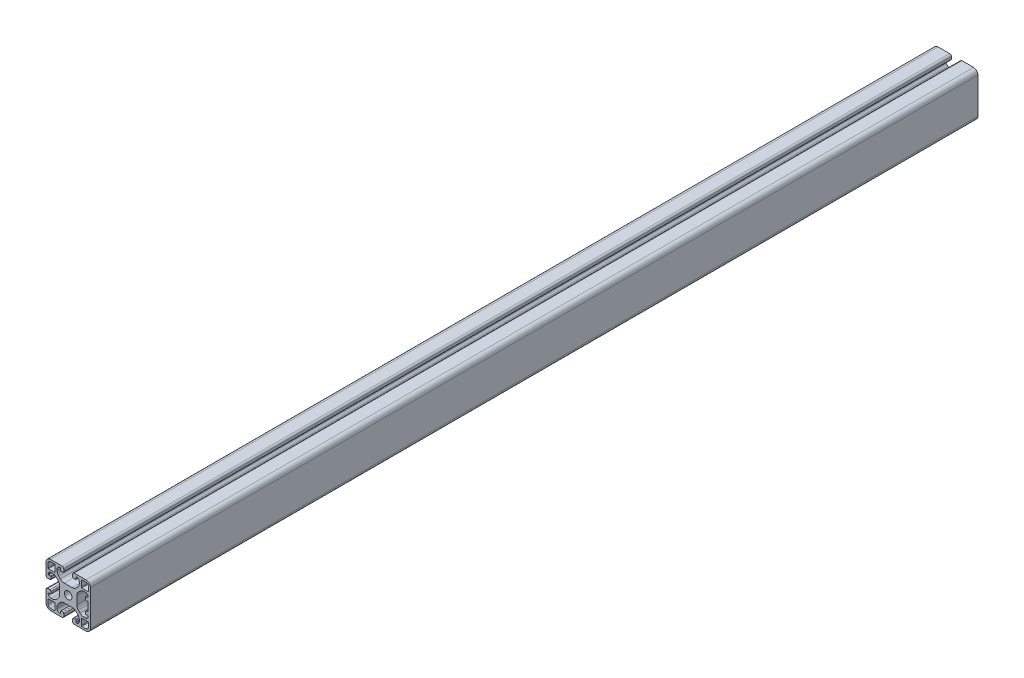
from build123d import *

# Parameters (mm, degrees)
SCHIZZO1_R                   = 3.4
ESTRUSIONE_ESTRUSIONE1_DEPTH = 800


with BuildPart() as part:
    # Schizzo1 → Estrusione-Estrusione1 (new body)
    with BuildSketch(Plane(origin=(0, 0, -340), x_dir=(-1, 0, 0), z_dir=(0, 0, -1))):
        with BuildLine():
            Line((6.5, -15.5), (5, -15.5))
            ThreePointArc((5, -15.5), (4.292893219, -15.792893219), (4, -16.5))
            Line((4, -16.5), (4, -18.5))
            ThreePointArc((4, -18.5), (4.439339828, -19.560660172), (5.5, -20))
            Line((5.5, -20), (16, -20))
            ThreePointArc((16, -20), (18.828427125, -18.828427125), (20, -16))
            Line((20, -16), (20, -5.5))
            ThreePointArc((20, -5.5), (19.560660172, -4.439339828), (18.5, -4))
            Line((18.5, -4), (16.5, -4))
            ThreePointArc((16.5, -4), (15.792893219, -4.292893219), (15.5, -5))
            Line((15.5, -5), (15.5, -6.5))
            ThreePointArc((15.5, -6.5), (15.646446609, -6.853553391), (16, -7))
            Line((16, -7), (17.55, -7))
            ThreePointArc((17.55, -7), (17.868198052, -7.131801948), (18, -7.45))
            Line((18, -7.45), (18, -7.5))
            ThreePointArc((18, -7.5), (17.267766953, -9.267766953), (15.5, -10))
            Line((15.5, -10), (14.192388155, -10))
            ThreePointArc((14.192388155, -10), (12.278970994, -9.619397663), (10.656854249, -8.535533906))
            Line((10.656854249, -8.535533906), (9.214466094, -7.09314575))
            ThreePointArc((9.214466094, -7.09314575), (8.130602337, -5.471029006), (7.75, -3.557611845))
            Line((7.75, -3.557611845), (7.75, 3.557611845))
            ThreePointArc((7.75, 3.557611845), (8.130602337, 5.471029006), (9.214466094, 7.09314575))
            Line((9.214466094, 7.09314575), (10.656854249, 8.535533906))
            ThreePointArc((10.656854249, 8.535533906), (12.278970994, 9.619397663), (14.192388155, 10))
            Line((14.192388155, 10), (15.5, 10))
            ThreePointArc((15.5, 10), (17.267766953, 9.267766953), (18, 7.5))
            Line((18, 7.5), (18, 7.45))
            ThreePointArc((18, 7.45), (17.868198052, 7.131801948), (17.55, 7))
            Line((17.55, 7), (16, 7))
            ThreePointArc((16, 7), (15.646446609, 6.853553391), (15.5, 6.5))
            Line((15.5, 6.5), (15.5, 5))
            ThreePointArc((15.5, 5), (15.792893219, 4.292893219), (16.5, 4))
            Line((16.5, 4), (18.5, 4))
            ThreePointArc((18.5, 4), (19.560660172, 4.439339828), (20, 5.5))
            Line((20, 5.5), (20, 16))
            ThreePointArc((20, 16), (18.828427125, 18.828427125), (16, 20))
            Line((16, 20), (5.5, 20))
            ThreePointArc((5.5, 20), (4.439339828, 19.560660172), (4, 18.5))
            Line((4, 18.5), (4, 16.5))
            ThreePointArc((4, 16.5), (4.292893219, 15.792893219), (5, 15.5))
            Line((5, 15.5), (6.5, 15.5))
            ThreePointArc((6.5, 15.5), (6.853553391, 15.646446609), (7, 16))
            Line((7, 16), (7, 17.55))
            ThreePointArc((7, 17.55), (7.131801948, 17.868198052), (7.45, 18))
            Line((7.45, 18), (7.5, 18))
            ThreePointArc((7.5, 18), (9.267766953, 17.267766953), (10, 15.5))
            Line((10, 15.5), (10, 14.192388155))
            ThreePointArc((10, 14.192388155), (9.619397663, 12.278970994), (8.535533906, 10.656854249))
            Line((8.535533906, 10.656854249), (7.09314575, 9.214466094))
            ThreePointArc((7.09314575, 9.214466094), (5.471029006, 8.130602337), (3.557611844, 7.75))
            Line((3.557611844, 7.75), (-3.557611845, 7.75))
            ThreePointArc((-3.557611845, 7.75), (-5.471029006, 8.130602337), (-7.09314575, 9.214466094))
            Line((-7.09314575, 9.214466094), (-8.535533906, 10.656854249))
            ThreePointArc((-8.535533906, 10.656854249), (-9.619397663, 12.278970994), (-10, 14.192388155))
            Line((-10, 14.192388155), (-10, 15.5))
            ThreePointArc((-10, 15.5), (-9.267766953, 17.267766953), (-7.5, 18))
            Line((-7.5, 18), (-7.45, 18))
            ThreePointArc((-7.45, 18), (-7.131801948, 17.868198052), (-7, 17.55))
            Line((-7, 17.55), (-7, 16))
            ThreePointArc((-7, 16), (-6.853553391, 15.646446609), (-6.5, 15.5))
            Line((-6.5, 15.5), (-5, 15.5))
            ThreePointArc((-5, 15.5), (-4.292893219, 15.792893219), (-4, 16.5))
            Line((-4, 16.5), (-4, 18.5))
            ThreePointArc((-4, 18.5), (-4.439339828, 19.560660172), (-5.5, 20))
            Line((-5.5, 20), (-16, 20))
            ThreePointArc((-16, 20), (-18.828427125, 18.828427125), (-20, 16))
            Line((-20, 16), (-20, -16))
            ThreePointArc((-20, -16), (-18.828427125, -18.828427125), (-16, -20))
            Line((-16, -20), (-5.5, -20))
            ThreePointArc((-5.5, -20), (-4.439339828, -19.560660172), (-4, -18.5))
            Line((-4, -18.5), (-4, -16.5))
            ThreePointArc((-4, -16.5), (-4.292893219, -15.792893219), (-5, -15.5))
            Line((-5, -15.5), (-6.5, -15.5))
            ThreePointArc((-6.5, -15.5), (-6.853553391, -15.646446609), (-7, -16))
            Line((-7, -16), (-7, -17.55))
            ThreePointArc((-7, -17.55), (-7.131801948, -17.868198052), (-7.45, -18))
            Line((-7.45, -18), (-7.5, -18))
            ThreePointArc((-7.5, -18), (-9.267766953, -17.267766953), (-10, -15.5))
            Line((-10, -15.5), (-10, -14.192388155))
            ThreePointArc((-10, -14.192388155), (-9.619397663, -12.278970994), (-8.535533906, -10.656854249))
            Line((-8.535533906, -10.656854249), (-7.09314575, -9.214466094))
            ThreePointArc((-7.09314575, -9.214466094), (-5.471029006, -8.130602337), (-3.557611845, -7.75))
            Line((-3.557611845, -7.75), (3.557611845, -7.75))
            ThreePointArc((3.557611845, -7.75), (5.471029006, -8.130602337), (7.09314575, -9.214466094))
            Line((7.09314575, -9.214466094), (8.535533906, -10.656854249))
            ThreePointArc((8.535533906, -10.656854249), (9.619397663, -12.278970994), (10, -14.192388155))
            Line((10, -14.192388155), (10, -15.5))
            ThreePointArc((10, -15.5), (9.267766953, -17.267766953), (7.5, -18))
            Line((7.5, -18), (7.45, -18))
            ThreePointArc((7.45, -18), (7.131801948, -17.868198052), (7, -17.55))
            Line((7, -17.55), (7, -16))
            ThreePointArc((7, -16), (6.853553391, -15.646446609), (6.5, -15.5))
        make_face()
        with Locations(Location((0, 0, 0), (0, 0, 180))):
            Circle(SCHIZZO1_R, mode=Mode.SUBTRACT)
        with BuildLine():
            Line((-12.3, -18.2), (-16, -18.2))
            ThreePointArc((-16, -18.2), (-17.555634919, -17.555634919), (-18.2, -16))
            Line((-18.2, -16), (-18.2, -12.3))
            ThreePointArc((-18.2, -12.3), (-18.053553391, -11.946446609), (-17.7, -11.8))
            Line((-17.7, -11.8), (-12.3, -11.8))
            ThreePointArc((-12.3, -11.8), (-11.946446609, -11.946446609), (-11.8, -12.3))
            Line((-11.8, -12.3), (-11.8, -17.7))
            ThreePointArc((-11.8, -17.7), (-11.946446609, -18.053553391), (-12.3, -18.2))
        make_face(mode=Mode.SUBTRACT)
        with BuildLine():
            Line((-11.8, 17.7), (-11.8, 12.3))
            ThreePointArc((-11.8, 12.3), (-11.946446609, 11.946446609), (-12.3, 11.8))
            Line((-12.3, 11.8), (-17.7, 11.8))
            ThreePointArc((-17.7, 11.8), (-18.053553391, 11.946446609), (-18.2, 12.3))
            Line((-18.2, 12.3), (-18.2, 16))
            ThreePointArc((-18.2, 16), (-17.555634919, 17.555634919), (-16, 18.2))
            Line((-16, 18.2), (-12.3, 18.2))
            ThreePointArc((-12.3, 18.2), (-11.946446609, 18.053553391), (-11.8, 17.7))
        make_face(mode=Mode.SUBTRACT)
        with BuildLine():
            Line((18.2, 16), (18.2, 12.3))
            ThreePointArc((18.2, 12.3), (18.053553391, 11.946446609), (17.7, 11.8))
            Line((17.7, 11.8), (12.3, 11.8))
            ThreePointArc((12.3, 11.8), (11.946446609, 11.946446609), (11.8, 12.3))
            Line((11.8, 12.3), (11.8, 17.7))
            ThreePointArc((11.8, 17.7), (11.946446609, 18.053553391), (12.3, 18.2))
            Line((12.3, 18.2), (16, 18.2))
            ThreePointArc((16, 18.2), (17.555634919, 17.555634919), (18.2, 16))
        make_face(mode=Mode.SUBTRACT)
        with BuildLine():
            Line((18.2, -12.3), (18.2, -16))
            ThreePointArc((18.2, -16), (17.555634919, -17.555634919), (16, -18.2))
            Line((16, -18.2), (12.3, -18.2))
            ThreePointArc((12.3, -18.2), (11.946446609, -18.053553391), (11.8, -17.7))
            Line((11.8, -17.7), (11.8, -12.3))
            ThreePointArc((11.8, -12.3), (11.946446609, -11.946446609), (12.3, -11.8))
            Line((12.3, -11.8), (17.7, -11.8))
            ThreePointArc((17.7, -11.8), (18.053553391, -11.946446609), (18.2, -12.3))
        make_face(mode=Mode.SUBTRACT)
        with BuildLine():
            Line((-16, 7), (-17.5, 7))
            ThreePointArc((-17.5, 7), (-17.853553391, 7.146446609), (-18, 7.5))
            ThreePointArc((-18, 7.5), (-17.267766953, 9.267766953), (-15.5, 10))
            Line((-15.5, 10), (-14.192388155, 10))
            ThreePointArc((-14.192388155, 10), (-12.278970994, 9.619397663), (-10.656854249, 8.535533906))
            Line((-10.656854249, 8.535533906), (-9.214466094, 7.093145751))
            ThreePointArc((-9.214466094, 7.093145751), (-8.130602337, 5.471029006), (-7.75, 3.557611845))
            Line((-7.75, 3.557611845), (-7.75, -3.557611845))
            ThreePointArc((-7.75, -3.557611845), (-8.130602337, -5.471029006), (-9.214466094, -7.093145751))
            Line((-9.214466094, -7.093145751), (-10.656854249, -8.535533906))
            ThreePointArc((-10.656854249, -8.535533906), (-12.278970994, -9.619397663), (-14.192388155, -10))
            Line((-14.192388155, -10), (-15.5, -10))
            ThreePointArc((-15.5, -10), (-17.267766953, -9.267766953), (-18, -7.5))
            ThreePointArc((-18, -7.5), (-17.853553391, -7.146446609), (-17.5, -7))
            Line((-17.5, -7), (-16, -7))
            ThreePointArc((-16, -7), (-15.646446609, -6.853553391), (-15.5, -6.5))
            Line((-15.5, -6.5), (-15.5, -5))
            ThreePointArc((-15.5, -5), (-15.792893219, -4.292893219), (-16.5, -4))
            Line((-16.5, -4), (-17.5, -4))
            ThreePointArc((-17.5, -4), (-17.853553391, -3.853553391), (-18, -3.5))
            Line((-18, -3.5), (-18, 3.5))
            ThreePointArc((-18, 3.5), (-17.853553391, 3.853553391), (-17.5, 4))
            Line((-17.5, 4), (-16.5, 4))
            ThreePointArc((-16.5, 4), (-15.792893219, 4.292893219), (-15.5, 5))
            Line((-15.5, 5), (-15.5, 6.5))
            ThreePointArc((-15.5, 6.5), (-15.646446609, 6.853553391), (-16, 7))
        make_face(mode=Mode.SUBTRACT)
    extrude(amount=-ESTRUSIONE_ESTRUSIONE1_DEPTH)


solid = part.part
